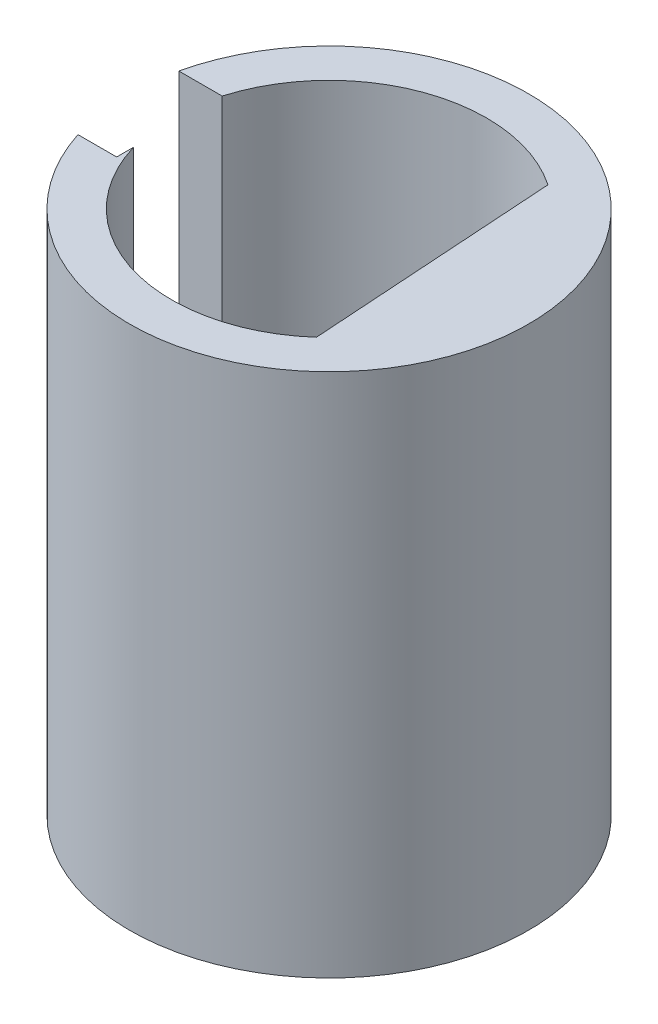
from build123d import *

# Parameters (mm, degrees)
SKETCH2_R           = 3.8
BOSS_EXTRUDE1_DEPTH = 10
SKETCH3_W           = 1.24695481
SKETCH3_H           = 2.009875944
CUT_EXTRUDE1_DEPTH  = 14


with BuildPart() as part:
    # Sketch2 → Boss-Extrude1 (new body)
    with BuildSketch(Plane(origin=(0, 0, 0), x_dir=(1, 0, 0), z_dir=(0, 1, 0))):
        with Locations(Location((0, 0, 0), (0, 0, 270))):
            Circle(SKETCH2_R)
        with BuildLine():
            Line((1.687331232, 2.480506665), (1.997007769, -2.23874071))
            ThreePointArc((1.997007769, -2.23874071), (-2.993561828, -0.196437226), (1.687331232, 2.480506665))
        make_face(mode=Mode.SUBTRACT)
    extrude(amount=BOSS_EXTRUDE1_DEPTH)

    # Sketch3 → Cut-Extrude1 (cut)
    with BuildSketch(Plane(origin=(0, 10, 0), x_dir=(1, 0, 0), z_dir=(0, 1, 0))):
        with Locations((-3.502544147, -0.161744818)):
            Rectangle(SKETCH3_W, SKETCH3_H)
    extrude(amount=-CUT_EXTRUDE1_DEPTH, mode=Mode.SUBTRACT)


solid = part.part
